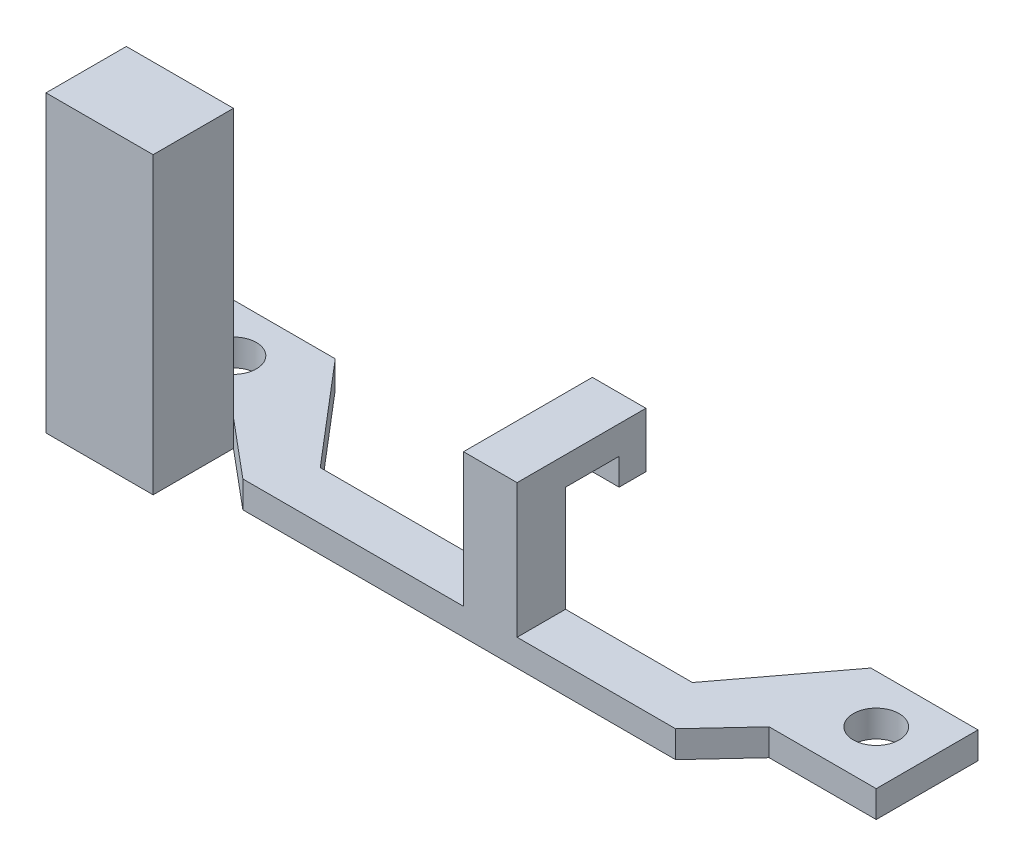
from build123d import *

# Parameters (mm, degrees)
SKETCH1_R                = 2.1717
BOSS_EXTRUDE1_DEPTH      = 2.54
BOSS_EXTRUDE2_DEPTH      = 25.4
BOSS_EXTRUDE2_DEPTH_BACK = 2.54
SKETCH2_W                = 10.16
SKETCH2_H                = 7.62
SKETCH3_W                = 5.08
SKETCH3_H                = 4.597654895
BOSS_EXTRUDE3_DEPTH      = 12.7
BOSS_EXTRUDE4_DEPTH      = 5.08


with BuildPart() as part:
    # Sketch1 → Boss-Extrude1 (new body)
    with BuildSketch(Plane(origin=(0, 0, 0), x_dir=(1, 0, 0), z_dir=(0, 1, 0))):
        Polygon((0, -5.08), (-5.08, -5.08), (-5.08, 4.572), (5.08, 4.572), (13.309339364, -5.08), (48.607458274, -5.08), (55.88, 4.572), (66.04, 4.572), (66.04, -5.08), (60.96, -5.08), (55.88, -5.08), (51.60608488, -9.677654895), (10.567737895, -9.677654895), (5.08, -5.08), align=None)
        with Locations(Location((0, 0, 0), (0, 0, 270))):
            Circle(SKETCH1_R, mode=Mode.SUBTRACT)
        with Locations(Location((60.96, 0, 0), (0, 0, 270))):
            Circle(SKETCH1_R, mode=Mode.SUBTRACT)
    extrude(amount=BOSS_EXTRUDE1_DEPTH)

    # Sketch2 → Boss-Extrude2 (add, two sides: drawn at the far end of the back side and taken through both)
    with BuildSketch(Plane(origin=(0, 2.54, 0), x_dir=(1, 0, 0), z_dir=(0, 1, 0)).offset(-BOSS_EXTRUDE2_DEPTH_BACK)):
        with Locations((0, -8.89)):
            Rectangle(SKETCH2_W, SKETCH2_H)
    extrude(amount=BOSS_EXTRUDE2_DEPTH + BOSS_EXTRUDE2_DEPTH_BACK)

    # Sketch3 → Boss-Extrude3 (add)
    with BuildSketch(Plane(origin=(0, 2.54, 0), x_dir=(1, 0, 0), z_dir=(0, 1, 0))):
        with Locations((34.036, -7.378827447)):
            Rectangle(SKETCH3_W, SKETCH3_H)
    extrude(amount=BOSS_EXTRUDE3_DEPTH)

    # Sketch4 → Boss-Extrude4 (add)
    with BuildSketch(Plane(origin=(36.576, 0, 0), x_dir=(0, 0, -1), z_dir=(1, 0, 0))):
        Polygon((-5.08, 15.24), (2.54, 15.24), (2.54, 10.026233787), (0, 10.026233787), (0, 12.566233787), (-5.08, 12.566233787), align=None)
    extrude(amount=-BOSS_EXTRUDE4_DEPTH)


solid = part.part
